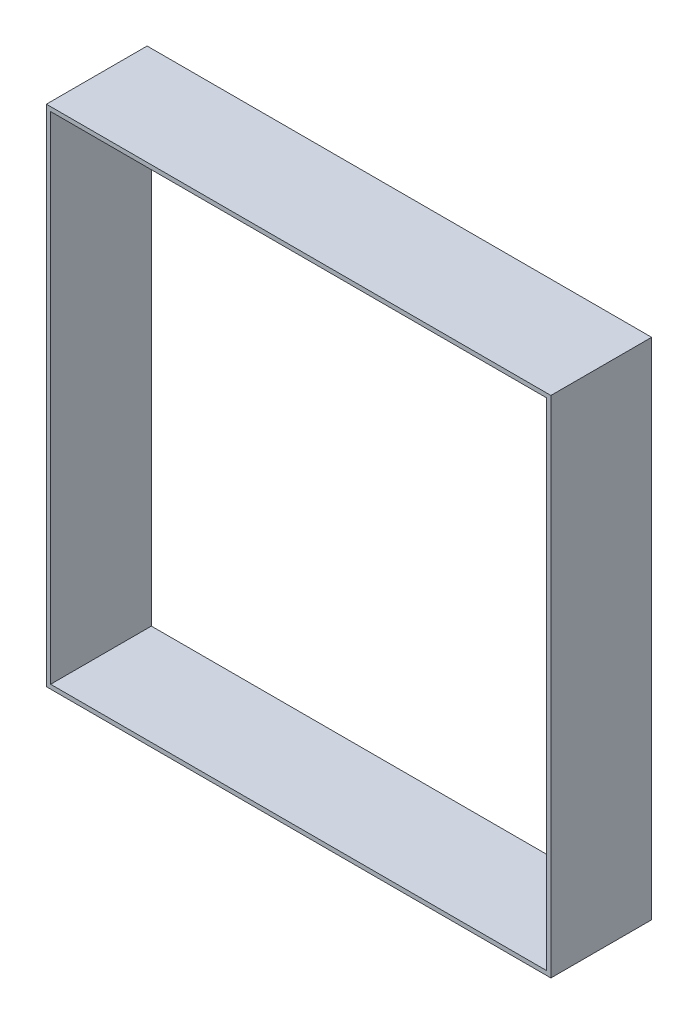
from build123d import *

# Parameters (mm, degrees)
SKETCH1_W           = 651
SKETCH1_H           = 651
SKETCH1_W_2         = 640
SKETCH1_H_2         = 640
BOSS_EXTRUDE1_DEPTH = 130


with BuildPart() as part:
    # Sketch1 → Boss-Extrude1 (new body)
    with BuildSketch(Plane.XY):
        Rectangle(SKETCH1_W, SKETCH1_H)
        Rectangle(SKETCH1_W_2, SKETCH1_H_2, mode=Mode.SUBTRACT)
    extrude(amount=BOSS_EXTRUDE1_DEPTH)


solid = part.part
